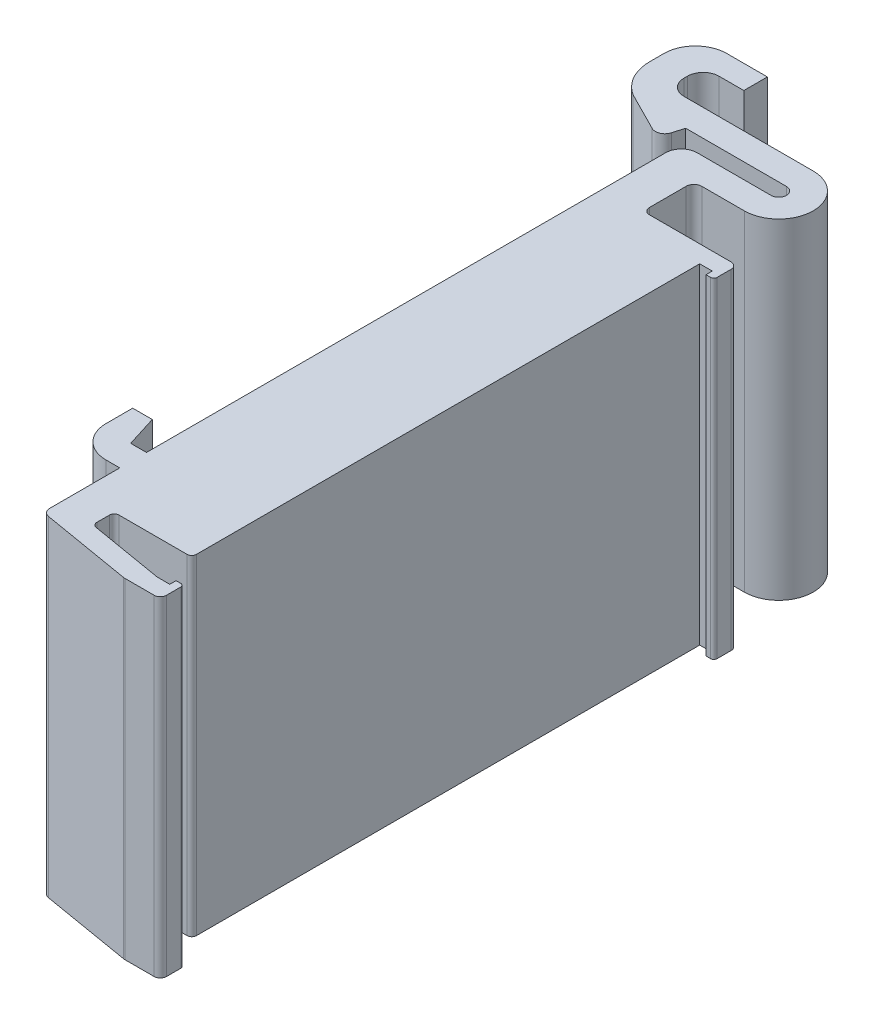
from build123d import *

# Parameters (mm, degrees)
BOSS_EXTRUDE2_DEPTH = 21


with BuildPart() as part:
    # Sketch1 → Boss-Extrude2 (new body)
    with BuildSketch(Plane(origin=(0, 0, 0), x_dir=(1, 0, 0), z_dir=(0, 1, 0))):
        with BuildLine():
            Line((-57.106413622, -7.464824426), (-59.629413704, -7.464824426))
            ThreePointArc((-59.629413704, -7.464824426), (-60.336520485, -7.171931207), (-60.629413704, -6.464824426))
            Line((-60.629413704, -6.464824426), (-60.629413704, -6.238826501))
            ThreePointArc((-60.629413704, -6.238826501), (-60.336520485, -5.53171972), (-59.629413704, -5.238826501))
            Line((-59.629413704, -5.238826501), (-58.046413759, -5.238826501))
            Line((-58.046413759, -5.238826501), (-58.046413759, -3.741824854))
            Line((-58.046413759, -3.741824854), (-60.629413704, -3.741824854))
            ThreePointArc((-60.629413704, -3.741824854), (-62.041505931, -4.326732605), (-62.626413683, -5.738824833))
            Line((-62.626413683, -5.738824833), (-62.626413683, -6.646827448))
            ThreePointArc((-62.626413683, -6.646827448), (-62.281482952, -7.988034096), (-61.33228598, -8.996417749))
            Line((-61.33228598, -8.996417749), (-58.867053131, -10.243427026))
            ThreePointArc((-58.867053131, -10.243427026), (-58.356925281, -10.257239692), (-58.022202829, -9.87203573))
            Line((-58.022202829, -9.87203573), (-57.819413522, -9.164825189))
            Line((-57.819413522, -9.164825189), (-51.406413416, -9.164825189))
            ThreePointArc((-51.406413416, -9.164825189), (-50.913413385, -9.65782522), (-51.406413416, -10.15082525))
            Line((-51.406413416, -10.15082525), (-56.106413702, -10.15082525))
            ThreePointArc((-56.106413702, -10.15082525), (-56.813520483, -10.443718469), (-57.106413702, -11.15082525))
            Line((-57.106413702, -11.15082525), (-57.106413702, -44.164825666))
            Line((-57.106413702, -44.164825666), (-58.111413816, -44.164825666))
            Line((-58.111413816, -44.164825666), (-58.738413671, -42.164826143))
            Line((-58.738413671, -42.164826143), (-59.984413723, -42.164826143))
            Line((-59.984413723, -42.164826143), (-59.984413723, -43.864825714))
            ThreePointArc((-59.984413723, -43.864825714), (-59.398627215, -45.279039445), (-57.984413484, -45.864825952))
            Line((-57.984413484, -45.864825952), (-57.106413702, -45.864825952))
            Line((-57.106413702, -45.864825952), (-57.106413702, -50.312660842))
            ThreePointArc((-57.106413702, -50.312660842), (-56.988345829, -50.635349314), (-56.6899023, -50.805641221))
            Line((-56.6899023, -50.805641221), (-50.947861868, -51.77808339))
            ThreePointArc((-50.947861868, -51.77808339), (-50.906264859, -51.783345015), (-50.864373269, -51.785103011))
            Line((-50.864373269, -51.785103011), (-49.006412669, -51.785103011))
            ThreePointArc((-49.006412669, -51.785103011), (-48.723569957, -51.667945724), (-48.606412669, -51.385103011))
            Line((-48.606412669, -51.385103011), (-48.606412669, -50.485103011))
            ThreePointArc((-48.606412669, -50.485103011), (-48.664991313, -50.343681655), (-48.806412669, -50.285103011))
            Line((-48.806412669, -50.285103011), (-49.106412669, -50.285103011))
            Line((-49.106412669, -50.285103011), (-49.106412669, -50.685103011))
            Line((-49.106412669, -50.685103011), (-49.822333869, -50.685103011))
            ThreePointArc((-49.822333869, -50.685103011), (-49.906117049, -50.68158702), (-49.989311067, -50.671063769))
            Line((-49.989311067, -50.671063769), (-54.586309617, -49.892539951))
            ThreePointArc((-54.586309617, -49.892539951), (-54.765375734, -49.790364807), (-54.836216458, -49.596751723))
            Line((-54.836216458, -49.596751723), (-54.836216458, -48.785103011))
            ThreePointArc((-54.836216458, -48.785103011), (-54.748348492, -48.572970977), (-54.536216458, -48.485103011))
            Line((-54.536216458, -48.485103011), (-50.206412669, -48.485103011))
            ThreePointArc((-50.206412669, -48.485103011), (-49.994280635, -48.397235046), (-49.906412669, -48.185103011))
            Line((-49.906412669, -48.185103011), (-49.906412669, -16.585103011))
            Line((-49.906412669, -16.585103011), (-49.906412669, -16.185103011))
            Line((-49.906412669, -16.185103011), (-49.106412669, -16.185103011))
            Line((-49.106412669, -16.185103011), (-49.106412669, -16.585103011))
            Line((-49.106412669, -16.585103011), (-48.806412669, -16.585103011))
            ThreePointArc((-48.806412669, -16.585103011), (-48.664991313, -16.526524367), (-48.606412669, -16.385103011))
            Line((-48.606412669, -16.385103011), (-48.606412669, -15.485103011))
            ThreePointArc((-48.606412669, -15.485103011), (-48.723569957, -15.202260299), (-49.006412669, -15.085103011))
            Line((-49.006412669, -15.085103011), (-53.806412669, -15.085103011))
            Line((-53.806412669, -15.085103011), (-54.206412669, -15.085103011))
            ThreePointArc((-54.206412669, -15.085103011), (-54.489255382, -14.967945724), (-54.606412669, -14.685103011))
            Line((-54.606412669, -14.685103011), (-54.606412669, -14.585103011))
            Line((-54.606412669, -14.585103011), (-54.606412669, -12.350826013))
            ThreePointArc((-54.606412669, -12.350826013), (-54.45996606, -11.997272623), (-54.106412669, -11.850826013))
            Line((-54.106412669, -11.850826013), (-51.40641286, -11.850826013))
            ThreePointArc((-51.40641286, -11.850826013), (-49.213412067, -9.65782522), (-51.40641286, -7.464824426))
            Line((-51.40641286, -7.464824426), (-54.106412669, -7.464824426))
            Line((-54.106412669, -7.464824426), (-57.106413622, -7.464824426))
        make_face()
    extrude(amount=BOSS_EXTRUDE2_DEPTH)


solid = part.part
